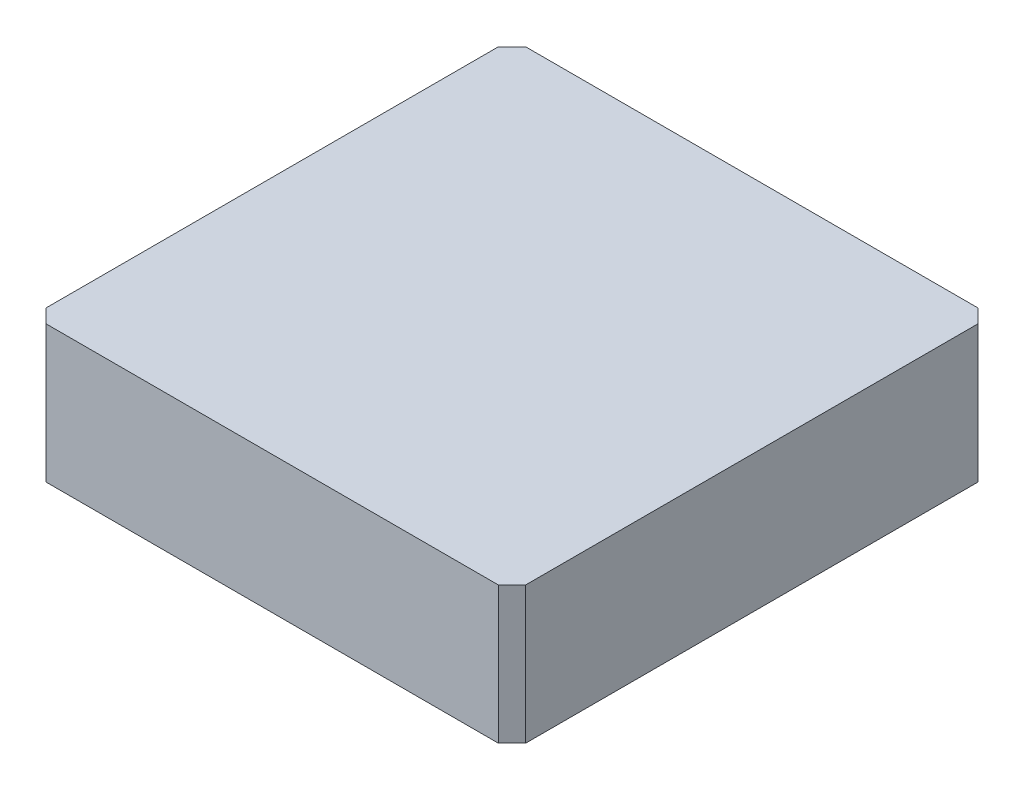
from build123d import *

# Parameters (mm, degrees)
SKETCH_1_W      = 70
SKETCH_1_H      = 70
EXTRUDE_1_DEPTH = 20
CHAMFER_1_SIZE  = 2


with BuildPart() as part:
    # 草图1 → 凸台-拉伸1 (new body)
    with BuildSketch(Plane(origin=(0, 0, 0), x_dir=(1, 0, 0), z_dir=(0, 1, 0))):
        Rectangle(SKETCH_1_W, SKETCH_1_H)
    extrude(amount=EXTRUDE_1_DEPTH)

    # 倒角1
    chamfer_1_edges = [part.edges().sort_by_distance(p)[0] for p in [
        (-35, 10, -35),
        (35, 10, -35),
        (35, 10, 35),
        (-35, 10, 35),
    ]]
    chamfer(chamfer_1_edges, length=CHAMFER_1_SIZE)


solid = part.part
